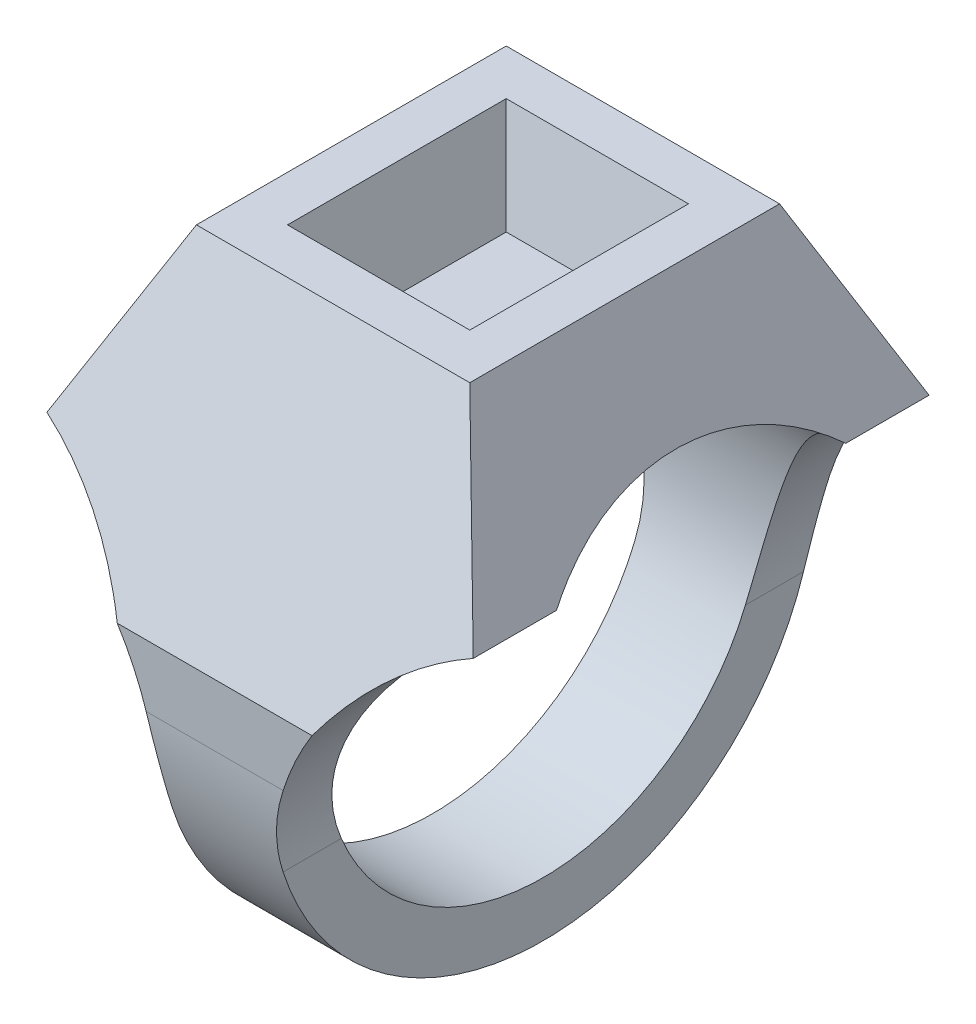
from build123d import *

# Parameters (mm, degrees)
SKETCH_1_R                    = 12
EXTRUDE_1_DEPTH               = 25
CUT_EXTRUDE_1_DEPTH           = 35.263683398
CUT_EXTRUDE_1_DEPTH_BACK      = 35.263683398
SKETCH_2_OUTSIDE_W            = 65.4
SKETCH_2_OUTSIDE_H            = 48.4
SKETCH_3_W                    = 10
SKETCH_3_H                    = 12
CUT_EXTRUDE_2_DEPTH           = 5
CUT_EXTRUDE_2_TAPER           = 15
CUT_EXTRUDE_2_OTHER_WAY_DEPTH = 39.089557823


with BuildPart() as part:
    # 草图1 → 凸台-拉伸1 (new, symmetric)
    with BuildSketch(Plane(origin=(0, 0, 0), x_dir=(0, 0, -1), z_dir=(1, 0, 0))):
        with BuildLine():
            Line((-8.5, 18), (8.5, 18))
            Line((8.5, 18), (15, 3.40076097))
            Line((15, 3.40076097), (15, 0))
            ThreePointArc((15, 0), (0, -15), (-15, 0))
            Line((-15, 0), (-15, 3.40076097))
            Line((-15, 3.40076097), (-8.5, 18))
        make_face()
        Circle(SKETCH_1_R, mode=Mode.SUBTRACT)
    extrude(amount=EXTRUDE_1_DEPTH, both=True)

    # 草图2 outside → 切除-拉伸1 (cut, two sides: drawn at the far end of the back side and taken through both)
    with BuildSketch(Plane.XY.offset(-CUT_EXTRUDE_1_DEPTH_BACK)):
        with Locations((0, 1.5)):
            Rectangle(SKETCH_2_OUTSIDE_W, SKETCH_2_OUTSIDE_H)
        with BuildLine():
            Line((-7.5, 18), (7.5, 18))
            Line((7.5, 18), (11.696768923, 9))
            ThreePointArc((11.696768923, 9), (5.385171162, 3.46487732), (3.03604285, -4.594616806))
            Line((3.03604285, -4.594616806), (3.03604285, -15))
            Line((3.03604285, -15), (-3.03604285, -15))
            Line((-3.03604285, -15), (-3.03604285, -4.594616806))
            ThreePointArc((-3.03604285, -4.594616806), (-5.385171162, 3.46487732), (-11.696768923, 9))
            Line((-11.696768923, 9), (-7.5, 18))
        make_face(mode=Mode.SUBTRACT)
    extrude(amount=CUT_EXTRUDE_1_DEPTH + CUT_EXTRUDE_1_DEPTH_BACK, mode=Mode.SUBTRACT)

    # 草图3 → 切除-拉伸2 (cut)
    with BuildSketch(Plane(origin=(0, 18, 0), x_dir=(1, 0, 0), z_dir=(0, 1, 0))):
        Rectangle(SKETCH_3_W, SKETCH_3_H)
    extrude(amount=-CUT_EXTRUDE_2_DEPTH, taper=CUT_EXTRUDE_2_TAPER, mode=Mode.SUBTRACT)

    # 草图3 → 切除-拉伸2 other way (cut)
    with BuildSketch(Plane(origin=(0, 18, 0), x_dir=(1, 0, 0), z_dir=(0, 1, 0))):
        Rectangle(SKETCH_3_W, SKETCH_3_H)
    extrude(amount=CUT_EXTRUDE_2_OTHER_WAY_DEPTH, mode=Mode.SUBTRACT)


solid = part.part
